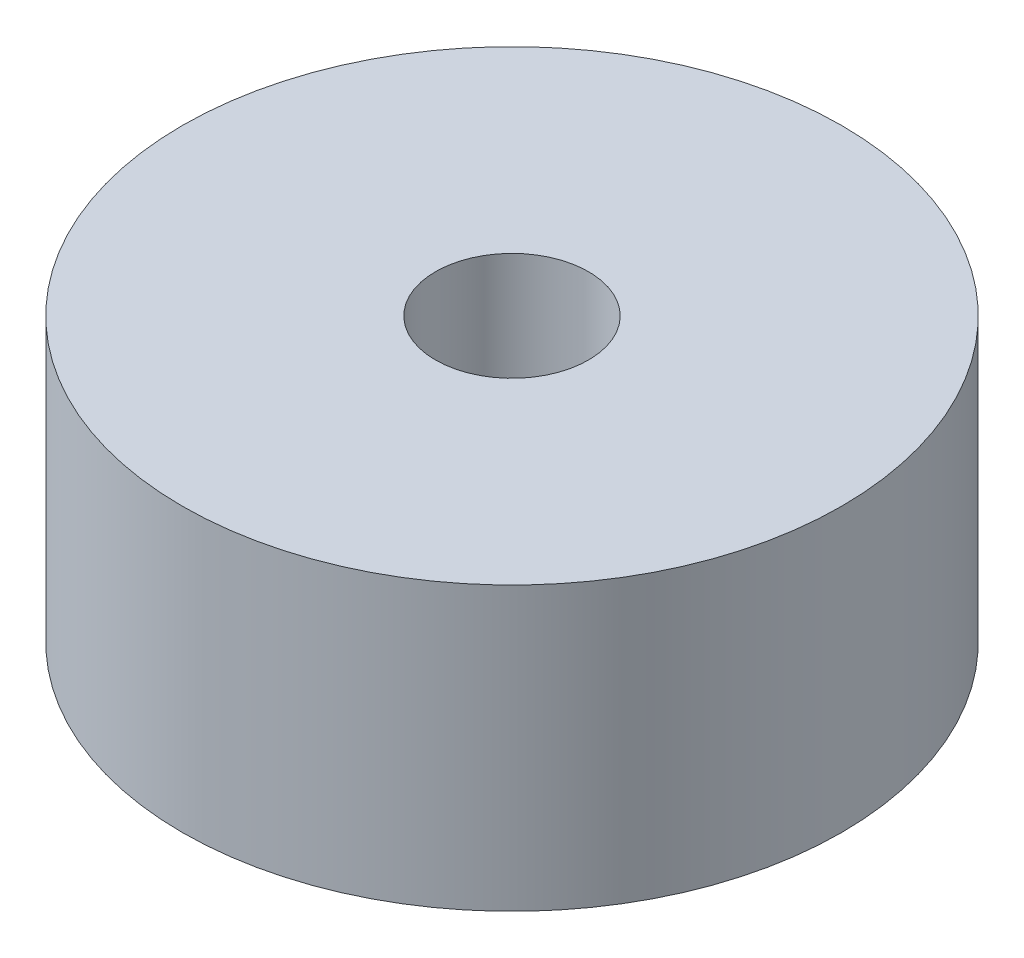
from build123d import *

# Parameters (mm, degrees)
SKETCH_1_R      = 5.6
SKETCH_1_R_2    = 1.3
EXTRUDE_1_DEPTH = 4.8


with BuildPart() as part:
    # 草图1 → 凸台-拉伸1 (new body)
    with BuildSketch(Plane(origin=(0, 0, 0), x_dir=(1, 0, 0), z_dir=(0, 1, 0))):
        Circle(SKETCH_1_R)
        Circle(SKETCH_1_R_2, mode=Mode.SUBTRACT)
    extrude(amount=EXTRUDE_1_DEPTH)


solid = part.part
